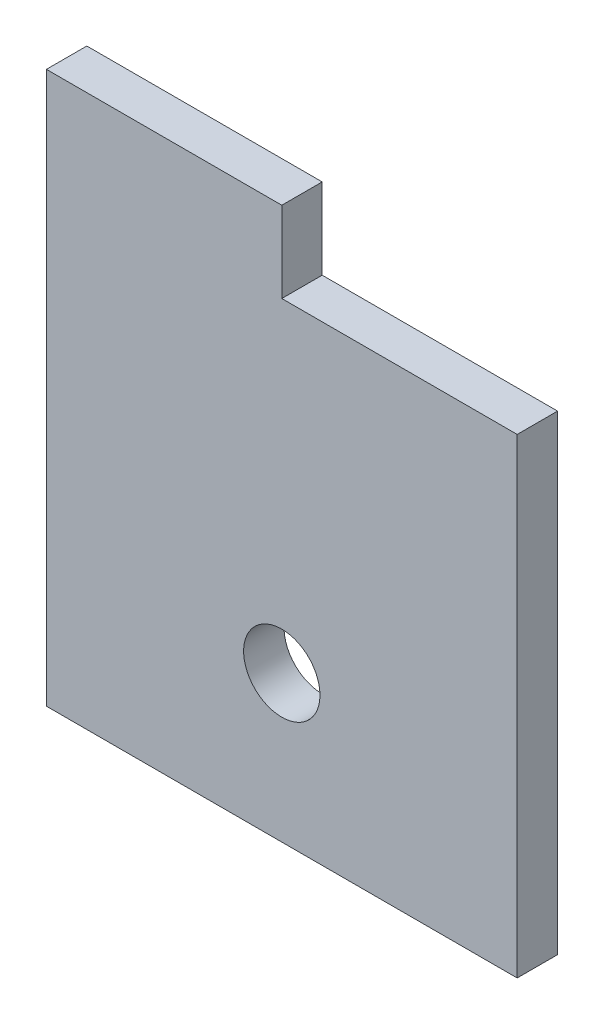
from build123d import *

# Parameters (mm, degrees)
SKETCH1_R           = 3
BOSS_EXTRUDE1_DEPTH = 3.175


with BuildPart() as part:
    # Sketch1 → Boss-Extrude1 (new body)
    with BuildSketch(Plane.XY):
        Polygon((18.5, 0), (37, 0), (37, 37), (18.5, 37), (18.5, 43.35), (0, 43.35), (0, 37), (0, 0), align=None)
        with Locations((18.5, 11.5)):
            Circle(SKETCH1_R, mode=Mode.SUBTRACT)
    extrude(amount=BOSS_EXTRUDE1_DEPTH)


solid = part.part
